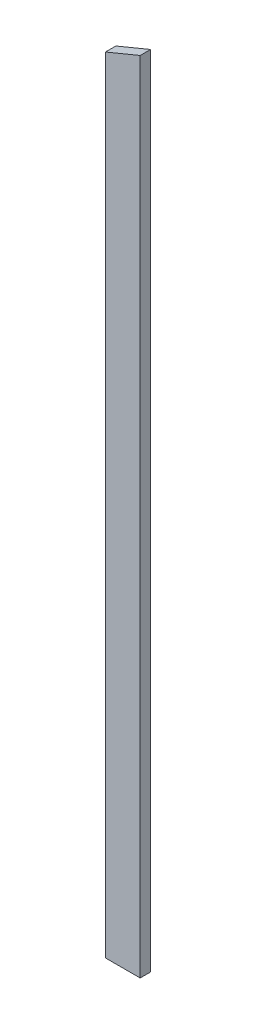
from build123d import *

# Parameters (mm, degrees)
BOSS_EXTRUDE1_DEPTH = 19.05


with BuildPart() as part:
    # Sketch4 → Boss-Extrude1 (new body)
    with BuildSketch(Plane.XY):
        Polygon((-140.28449825, -3.903212814), (-203.78449825, -3.903212814), (-203.78449825, 1429.84294537), (-140.28449825, 1456.145506581), align=None)
    extrude(amount=BOSS_EXTRUDE1_DEPTH)


solid = part.part
